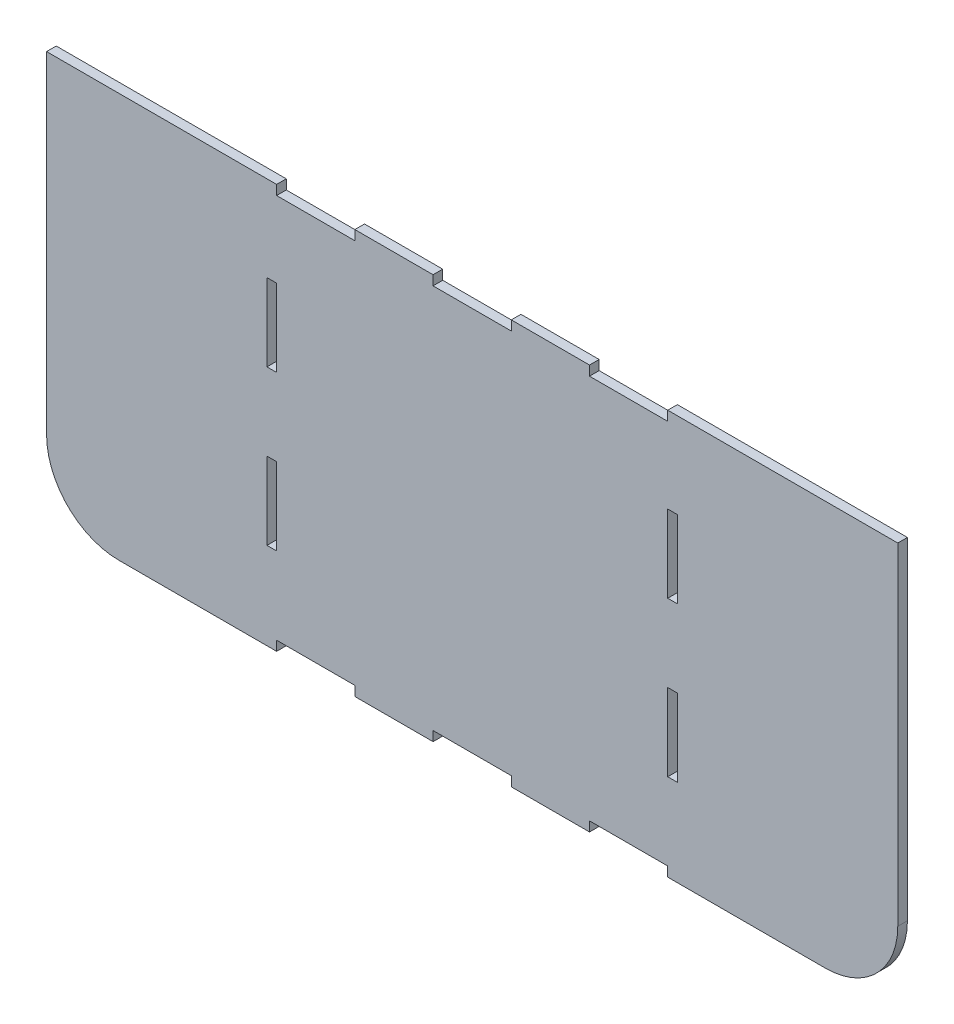
from build123d import *

# Parameters (mm, degrees)
BOSS_EXTRUDE1_DEPTH = 10.16
SKETCH2_W           = 10.166490401
SKETCH2_H           = 81.316938585
SKETCH2_W_2         = 10.166490402
SKETCH2_H_2         = 81.316938584
SKETCH2_W_3         = 82.271298803
SKETCH2_H_3         = 10.16
CUT_EXTRUDE2_DEPTH  = 137.414
CUT_EXTRUDE3_DEPTH  = 1426.179737238
SKETCH5_W           = 82.296
SKETCH5_H           = 10.16
CUT_EXTRUDE4_DEPTH  = 1408.779997291
CUT_EXTRUDE5_DEPTH  = 1408.779997291
CUT_EXTRUDE6_DEPTH  = 25.4


with BuildPart() as part:
    # Sketch1 → Boss-Extrude1 (new body)
    with BuildSketch(Plane.XY):
        with BuildLine():
            Line((0, 0), (1345.447057269, 0))
            Line((1345.447057269, 0), (1156.937235756, -454.288839135))
            add(Edge.make_bspline(
                [(1156.937235756, -454.288839135), (1155.965204773, -456.631331547), (1154.630956054, -458.816896883), (1152.225947859, -461.69350105), (1151.355065983, -462.590813772), (1149.473312624, -464.260936999), (1148.45987476, -465.033112958), (1146.360299176, -466.401155283), (1145.26635201, -467.004685932), (1142.990856866, -468.052074807), (1141.798989191, -468.498505895), (1138.174492983, -469.560599459), (1135.699262078, -469.911644948), (1133.16419506, -469.9)],
                knots=[0, 0, 0, 0, 0.25, 0.25, 0.375, 0.375, 0.5, 0.5, 0.625, 0.625, 0.75, 0.75, 1, 1, 1, 1], degree=3))
            Line((1133.16419506, -469.9), (212.282862208, -469.9))
            add(Edge.make_bspline(
                [(188.509821513, -454.288839135), (189.481852496, -456.631331547), (190.816101215, -458.816896883), (193.22110941, -461.69350105), (194.091991286, -462.590813772), (195.973744645, -464.260936999), (196.987182509, -465.033112958), (199.086758093, -466.401155283), (200.180705259, -467.004685932), (202.456200403, -468.052074807), (203.648068078, -468.498505895), (207.272564286, -469.560599459), (209.747795191, -469.911644948), (212.282862208, -469.9)],
                knots=[0, 0, 0, 0, 0.25, 0.25, 0.375, 0.375, 0.5, 0.5, 0.625, 0.625, 0.75, 0.75, 1, 1, 1, 1], degree=3))
            Line((188.509821513, -454.288839135), (0, 0))
        make_face()
    extrude(amount=BOSS_EXTRUDE1_DEPTH)

    # Sketch2 → Cut-Extrude2 (cut)
    with BuildSketch(Plane.XY.offset(10.16)):
        with Locations((461.924984631, -337.764592123)):
            Rectangle(SKETCH2_W, SKETCH2_H)
        with Locations((883.522072638, -337.764592123)):
            Rectangle(SKETCH2_W_2, SKETCH2_H)
        with Locations((883.522072638, -175.130714953)):
            Rectangle(SKETCH2_W_2, SKETCH2_H_2)
        with Locations((461.924984631, -175.130714953)):
            Rectangle(SKETCH2_W, SKETCH2_H_2)
        with Locations((837.303178036, -464.82)):
            Rectangle(SKETCH2_W_3, SKETCH2_H_3)
        with Locations((672.723528635, -464.82)):
            Rectangle(SKETCH2_W_3, SKETCH2_H_3)
        with Locations((508.143879233, -464.82)):
            Rectangle(SKETCH2_W_3, SKETCH2_H_3)
    extrude(amount=-CUT_EXTRUDE2_DEPTH, mode=Mode.SUBTRACT)

    # Sketch4 → Cut-Extrude3 (cut, through all)
    with BuildSketch(Plane.XY.offset(10.16)):
        Polygon((0, 0), (1345.447057269, 0), (1327.002268746, -44.45), (18.444788523, -44.45), align=None)
    extrude(amount=-CUT_EXTRUDE3_DEPTH, mode=Mode.SUBTRACT)

    # Sketch5 → Cut-Extrude4 (cut, through all)
    with BuildSketch(Plane.XY.offset(10.16)):
        with Locations((508.131528634, -49.53)):
            Rectangle(SKETCH5_W, SKETCH5_H)
        with Locations((672.723528634, -49.53)):
            Rectangle(SKETCH5_W, SKETCH5_H)
        with Locations((837.315528634, -49.53)):
            Rectangle(SKETCH5_W, SKETCH5_H)
    extrude(amount=-CUT_EXTRUDE4_DEPTH, mode=Mode.SUBTRACT)

    # Sketch6 → Cut-Extrude5 (cut, through all)
    with BuildSketch(Plane.XY.offset(10.16)):
        Polygon((192.807539001, -448.077869782), (224.982862208, -469.9), (232.080223429, -549.766419732), (-59.510742861, -242.335130221), (-120.238907144, 37.382474964), (56.544788523, -44.45), (56.544788523, -119.698975594), align=None)
        Polygon((1120.46419506, -469.9), (1113.36683384, -549.766419732), (1404.95780013, -242.335130221), (1465.685964413, 37.382474964), (1288.902268746, -44.45), (1288.902268746, -119.698975594), (1152.639518267, -448.077869782), align=None)
    extrude(amount=-CUT_EXTRUDE5_DEPTH, mode=Mode.SUBTRACT)

    # Sketch7 → Cut-Extrude6 (cut)
    with BuildSketch(Plane.XY.offset(10.16)):
        with BuildLine():
            Line((301.182862208, -469.9), (-145.537284928, -469.9))
            Line((-145.537284928, -469.9), (-145.537284928, 127.88628448))
            Line((-145.537284928, 127.88628448), (224.982862208, 127.88628448))
            Line((224.982862208, 127.88628448), (224.982862208, -393.7))
            ThreePointArc((224.982862208, -393.7), (247.301325482, -447.581536726), (301.182862208, -469.9))
        make_face()
        with BuildLine():
            Line((1044.26419506, -469.9), (1351.858793672, -469.9))
            Line((1351.858793672, -469.9), (1351.858793672, 23.69842382))
            Line((1351.858793672, 23.69842382), (1120.46419506, 23.69842382))
            Line((1120.46419506, 23.69842382), (1120.46419506, -393.7))
            ThreePointArc((1120.46419506, -393.7), (1098.145731787, -447.581536726), (1044.26419506, -469.9))
        make_face()
    extrude(amount=-CUT_EXTRUDE6_DEPTH, mode=Mode.SUBTRACT)


solid = part.part
